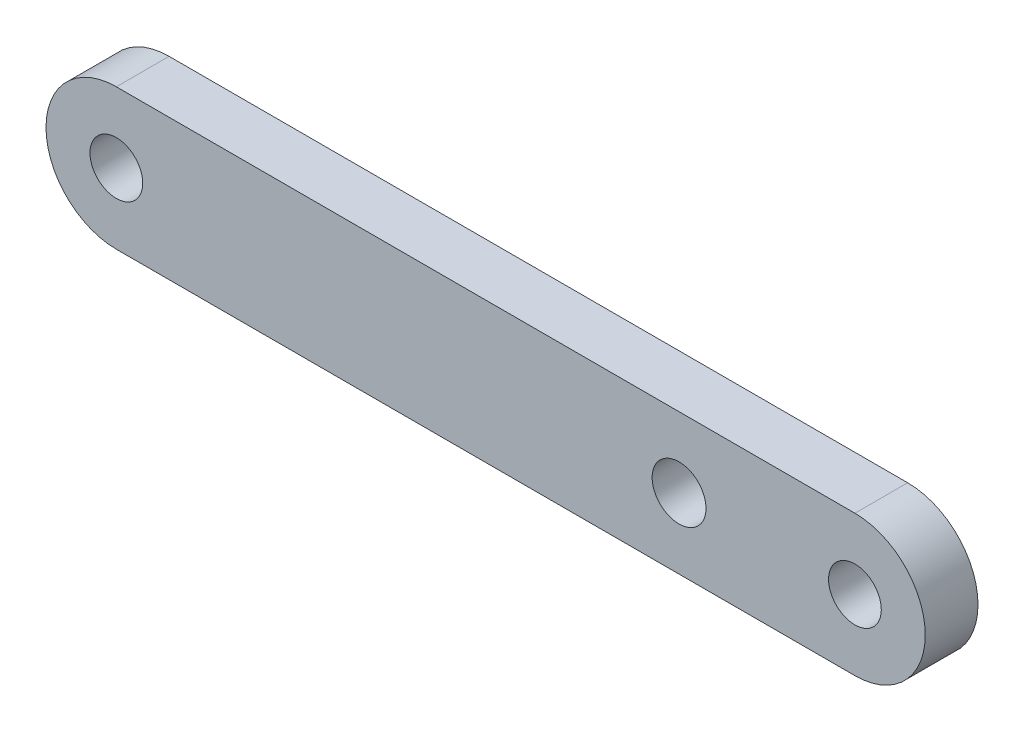
from build123d import *

# Parameters (mm, degrees)
BOSS_EXTRUDE1_DEPTH = 15
SKETCH4_R           = 7.5
CUT_EXTRUDE1_DEPTH  = 128.47548784
SKETCH5_R           = 7.656287761
CUT_EXTRUDE2_DEPTH  = 128.47548784


with BuildPart() as part:
    # Sketch1 → Boss-Extrude1 (new body)
    with BuildSketch(Plane.XY):
        with BuildLine():
            Line((-105, -20), (105, -20))
            ThreePointArc((105, -20), (125, 0), (105, 20))
            Line((105, 20), (-105, 20))
            ThreePointArc((-105, 20), (-125, 0), (-105, -20))
        make_face()
    extrude(amount=BOSS_EXTRUDE1_DEPTH)

    # Sketch4 → Cut-Extrude1 (cut, through all)
    with BuildSketch(Plane.XY.offset(15)):
        with Locations((105, 0)):
            Circle(SKETCH4_R)
    cut_extrude1 = extrude(amount=-CUT_EXTRUDE1_DEPTH, mode=Mode.SUBTRACT)

    # Mirror1: Cut-Extrude1 across plane
    add(cut_extrude1.mirror(Plane(origin=(0, 0, 0), x_dir=(0, 0, 1), z_dir=(1, 0, 0))), mode=Mode.SUBTRACT)

    # Sketch5 → Cut-Extrude2 (cut, through all)
    with BuildSketch(Plane.XY.offset(15)):
        with Locations((55, 0)):
            Circle(SKETCH5_R)
    extrude(amount=-CUT_EXTRUDE2_DEPTH, mode=Mode.SUBTRACT)


solid = part.part
